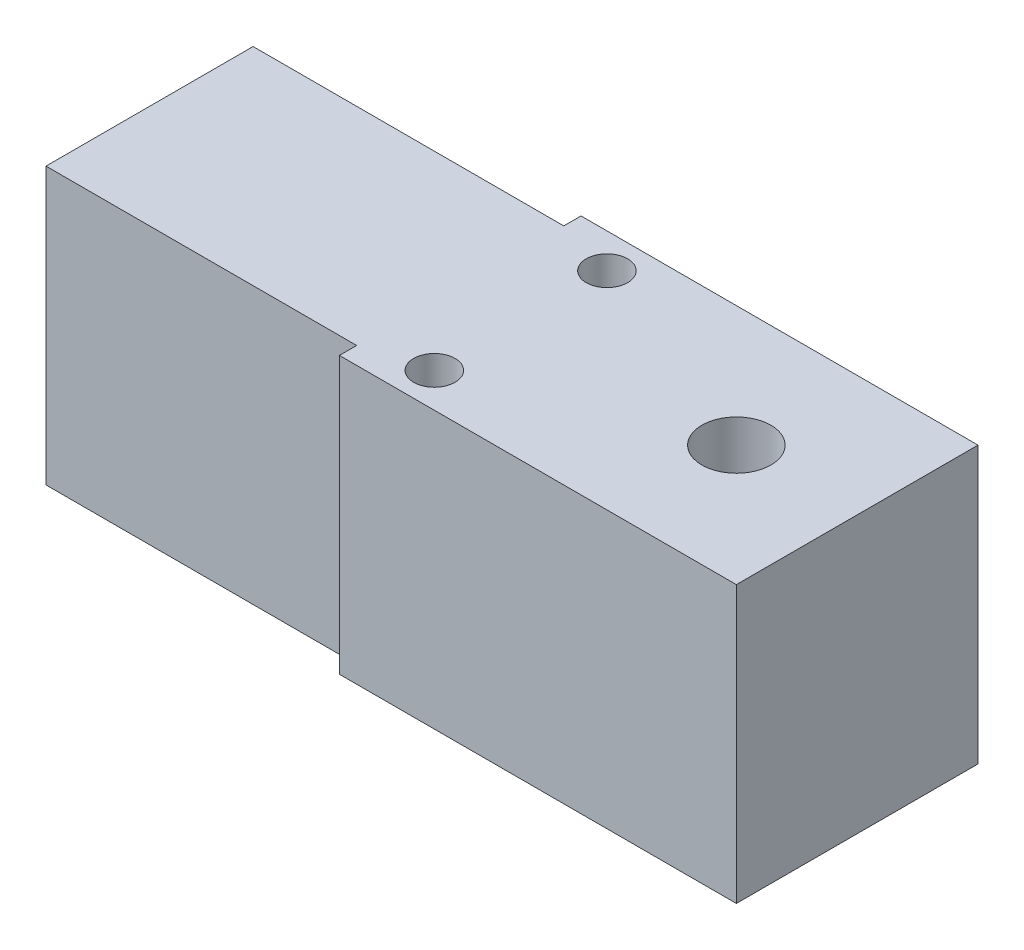
from build123d import *

# Parameters (mm, degrees)
SKETCH1_W               = 28.575
SKETCH1_H               = 19.05
BOSS_EXTRUDE1_DEPTH     = 12.7
SKETCH3_R               = 1.905
CUT_EXTRUDE1_DEPTH      = 46.845504823
CUT_EXTRUDE4_DEPTH      = 41.223628783
CUT_EXTRUDE4_DEPTH_BACK = 41.223628783
SKETCH2_R               = 3.175


with BuildPart() as part:
    # Sketch1 → Boss-Extrude1 (new, symmetric)
    with BuildSketch(Plane(origin=(0, 0, 0), x_dir=(1, 0, 0), z_dir=(0, 1, 0))):
        with Locations((-14.2875, 0)):
            Rectangle(SKETCH1_W, SKETCH1_H)
        Polygon((0, 9.525), (0, -9.525), (0, -11.1125), (36.5125, -11.1125), (36.5125, 11.1125), (0, 11.1125), align=None)
    extrude(amount=BOSS_EXTRUDE1_DEPTH, both=True)

    # Sketch3 → Cut-Extrude1 (cut, through all)
    with BuildSketch(Plane.XZ.offset(12.7)):
        with Locations(Location((5.55625, 7.9375, 0), (0, 0, 270))):
            Circle(SKETCH3_R)
        with Locations(Location((5.55625, -7.9375, 0), (0, 0, 270))):
            Circle(SKETCH3_R)
    extrude(amount=-CUT_EXTRUDE1_DEPTH, mode=Mode.SUBTRACT)

    # Sketch2 → Cut-Extrude4 (cut, two sides: drawn at the far end of the back side and taken through both)
    with BuildSketch(Plane.XZ.offset(-CUT_EXTRUDE4_DEPTH_BACK)):
        with Locations(Location((25.4, 0, 0), (0, 0, 270))):
            Circle(SKETCH2_R)
    extrude(amount=CUT_EXTRUDE4_DEPTH + CUT_EXTRUDE4_DEPTH_BACK, mode=Mode.SUBTRACT)


solid = part.part
